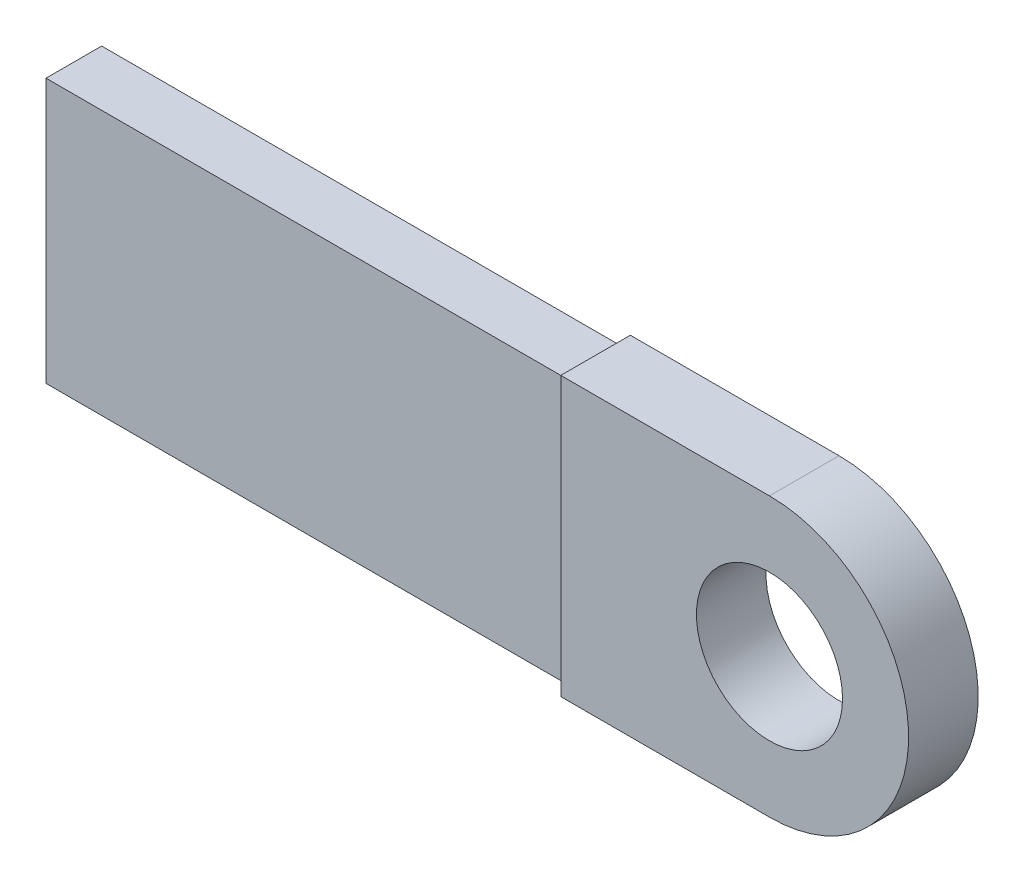
from build123d import *

# Parameters (mm, degrees)
BOSS_EXTRUDE1_DEPTH = 20
SKETCH2_R           = 21
CUT_EXTRUDE1_DEPTH  = 130.614813968
SKETCH3_W           = 16
SKETCH3_H           = 76
BOSS_EXTRUDE2_DEPTH = 150


with BuildPart() as part:
    # Sketch1 → Boss-Extrude1 (new body)
    with BuildSketch(Plane.XY):
        with BuildLine():
            Line((0, 80), (0, 0))
            Line((0, 0), (60, 0))
            ThreePointArc((60, 0), (88.284271247, 11.715728753), (100, 40))
            ThreePointArc((100, 40), (88.284271247, 68.284271247), (60, 80))
            Line((60, 80), (0, 80))
        make_face()
    extrude(amount=BOSS_EXTRUDE1_DEPTH)

    # Sketch2 → Cut-Extrude1 (cut, through all)
    with BuildSketch(Plane.XY.offset(20)):
        with Locations((60, 40)):
            Circle(SKETCH2_R)
    extrude(amount=-CUT_EXTRUDE1_DEPTH, mode=Mode.SUBTRACT)

    # Sketch3 → Boss-Extrude2 (add)
    with BuildSketch(Plane.ZY):
        with Locations((10, 40)):
            Rectangle(SKETCH3_W, SKETCH3_H)
    extrude(amount=BOSS_EXTRUDE2_DEPTH)


solid = part.part
